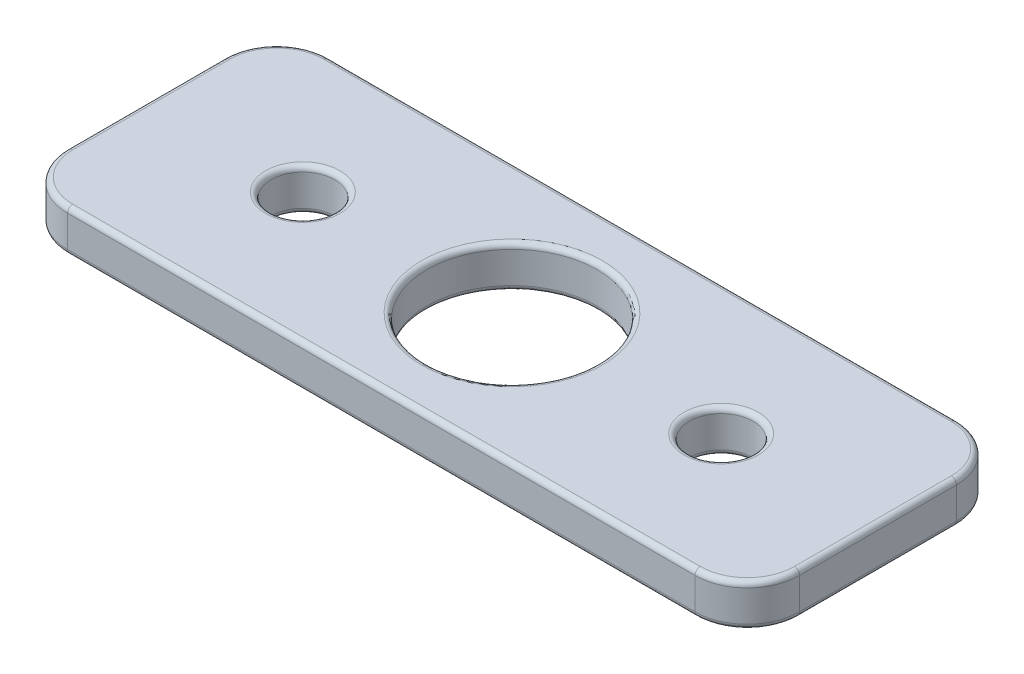
from build123d import *

# Parameters (mm, degrees)
SKETCH1_W           = 70
SKETCH1_H           = 25
SKETCH1_R           = 3.05
SKETCH1_R_2         = 8.15
BOSS_EXTRUDE1_DEPTH = 4
FILLET1_R           = 5
FILLET2_R           = 0.5


with BuildPart() as part:
    # Sketch1 → Boss-Extrude1 (new body)
    with BuildSketch(Plane(origin=(0, 0, 0), x_dir=(1, 0, 0), z_dir=(0, 1, 0))):
        with Locations((35, 12.5)):
            Rectangle(SKETCH1_W, SKETCH1_H)
        with Locations(Location((15, 12.5, 0), (0, 0, 270))):
            Circle(SKETCH1_R, mode=Mode.SUBTRACT)
        with Locations(Location((35, 12.5, 0), (0, 0, 270))):
            Circle(SKETCH1_R_2, mode=Mode.SUBTRACT)
        with Locations(Location((55, 12.5, 0), (0, 0, 90))):
            Circle(SKETCH1_R, mode=Mode.SUBTRACT)
    extrude(amount=BOSS_EXTRUDE1_DEPTH)

    # Fillet1
    fillet1_edges = [part.edges().sort_by_distance(p)[0] for p in [
        (0, 2, -25),
        (70, 2, -25),
        (70, 2, 0),
        (0, 2, 0),
    ]]
    fillet(fillet1_edges, radius=FILLET1_R)

    # Fillet2
    fillet2_edges = [part.edges().sort_by_distance(p)[0] for p in [
        (15, 0, -15.55),
        (15, 4, -15.55),
        (35, 0, -20.65),
        (35, 4, -20.65),
        (55, 0, -9.45),
        (55, 4, -9.45),
        (35, 0, -25),
        (35, 4, -25),
        (0, 0, -12.5),
        (70, 0, -12.5),
        (35, 0, 0),
        (68.535533906, 0, -1.464466094),
        (1.464466094, 0, -1.464466094),
        (1.464466094, 0, -23.535533906),
        (68.535533906, 0, -23.535533906),
        (70, 4, -12.5),
        (0, 4, -12.5),
        (35, 4, 0),
        (68.535533906, 4, -1.464466094),
        (1.464466094, 4, -1.464466094),
        (1.464466094, 4, -23.535533906),
        (68.535533906, 4, -23.535533906),
    ]]
    fillet(fillet2_edges, radius=FILLET2_R)


solid = part.part
